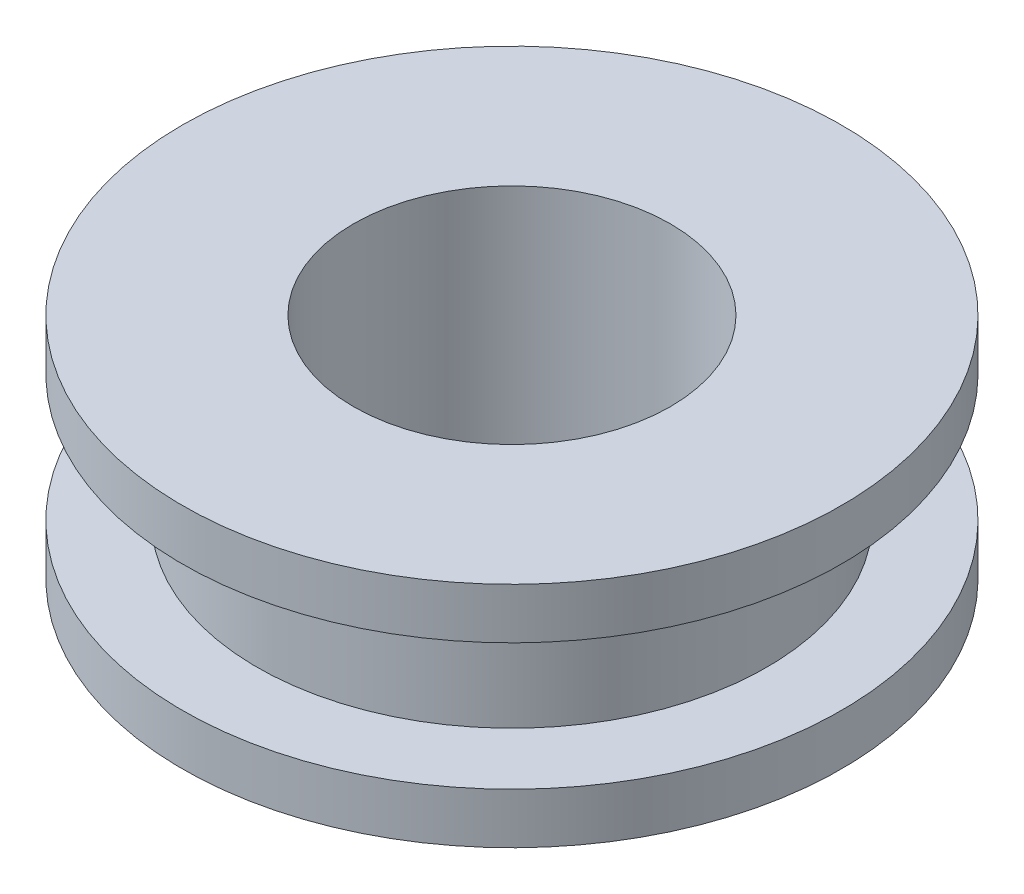
from build123d import *

# Parameters (mm, degrees)
SKETCH3_R          = 25
CUT_EXTRUDE1_DEPTH = 10
SKETCH5_R          = 25
CUT_EXTRUDE2_DEPTH = 36


with BuildPart() as part:
    # Sketch2 → Revolve1 (revolve)
    with BuildSketch(Plane.XY, mode=Mode.PRIVATE) as revolve1_sk:
        Polygon((0, 0), (52, 0), (52, 8), (40.216748768, 8), (40.216748768, 28), (52, 28), (52, 36), (0, 36), align=None)
    revolve(revolve1_sk.sketch.rotate(Axis((0, 36, 0), (0, -1, 0)), 180), axis=Axis((0, 36, 0), (0, -1, 0)))

    # Sketch3 → Cut-Extrude1 (cut)
    with BuildSketch(Plane(origin=(0, 36, 0), x_dir=(1, 0, 0), z_dir=(0, 1, 0))):
        with Locations(Location((0, 0, 0), (0, 0, 180))):
            Circle(SKETCH3_R)
    extrude(amount=-CUT_EXTRUDE1_DEPTH, mode=Mode.SUBTRACT)

    # Sketch5 → Cut-Extrude2 (cut)
    with BuildSketch(Plane(origin=(0, 26, 0), x_dir=(1, 0, 0), z_dir=(0, 1, 0))):
        with Locations(Location((0, 0, 0), (0, 0, 180))):
            Circle(SKETCH5_R)
    extrude(amount=-CUT_EXTRUDE2_DEPTH, mode=Mode.SUBTRACT)


solid = part.part
